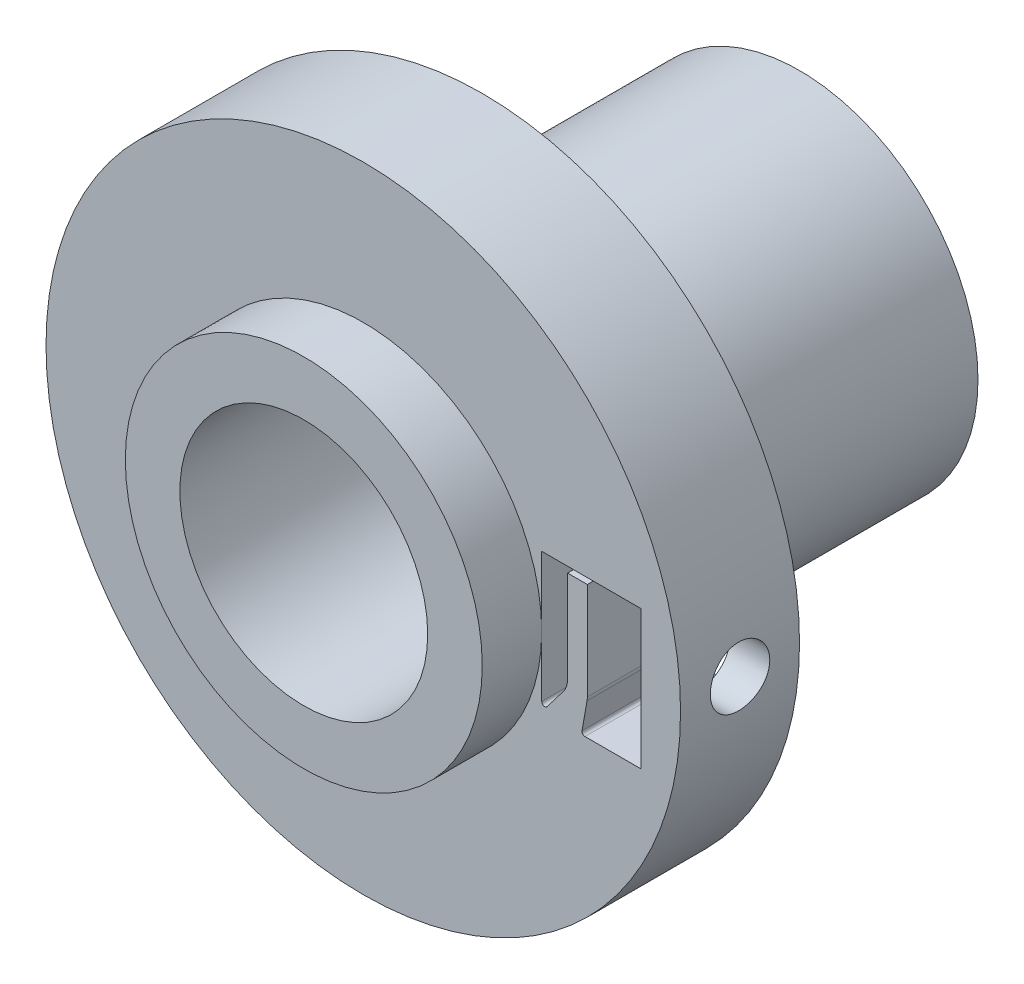
from build123d import *

# Parameters (mm, degrees)
SKIZZE1_R                       = 9
SKIZZE1_R_2                     = 6.25
AUFSATZ_LINEAR_AUSTRAGEN1_DEPTH = 8
SKIZZE2_R                       = 16
SKIZZE2_R_2                     = 6.25
AUFSATZ_LINEAR_AUSTRAGEN2_DEPTH = 6
SCHNITT_LINEAR_AUSTRAGEN1_DEPTH = 6
SCHNITT_LINEAR_START            = 17
SKIZZE4_R                       = 1.5
SCHNITT_LINEAR_AUSTRAGEN2_DEPTH = 4
SKIZZE5_R                       = 9
SKIZZE5_R_2                     = 6.25
AUFSATZ_LINEAR_AUSTRAGEN3_DEPTH = 3
VERRUNDUNG1_R                   = 0.15
VERRUNDUNG2_R                   = 0.15


with BuildPart() as part:
    # Skizze1 → Aufsatz-Linear austragen1 (new, symmetric)
    with BuildSketch(Plane.XY):
        Circle(SKIZZE1_R)
        Circle(SKIZZE1_R_2, mode=Mode.SUBTRACT)
    extrude(amount=AUFSATZ_LINEAR_AUSTRAGEN1_DEPTH, both=True)

    # Skizze2 → Aufsatz-Linear austragen2 (add)
    with BuildSketch(Plane.XY.offset(8)):
        Circle(SKIZZE2_R)
        Circle(SKIZZE2_R_2, mode=Mode.SUBTRACT)
    extrude(amount=AUFSATZ_LINEAR_AUSTRAGEN2_DEPTH)

    # Skizze3 → Schnitt-Linear austragen1 (cut)
    with BuildSketch(Plane(origin=(0, 0, 8), x_dir=(-1, 0, 0), z_dir=(0, 0, -1))):
        with BuildLine():
            Line((-9, -3.5), (-10.094357833, -2.06891668))
            ThreePointArc((-10.094357833, -2.06891668), (-10.24719529, -1.78212384), (-10.3, -1.461466572))
            Line((-10.3, -1.461466572), (-10.3, 3.2))
            Line((-10.3, 3.2), (-11.3, 3.2))
            Line((-11.3, 3.2), (-11.3, -1.712441166))
            ThreePointArc((-11.3, -1.712441166), (-11.296188626, -1.799666281), (-11.284783559, -1.8862265))
            Line((-11.284783559, -1.8862265), (-11, -3.5))
            Line((-11, -3.5), (-14, -3.5))
            Line((-14, -3.5), (-14, 3.5))
            Line((-14, 3.5), (-9, 3.5))
            Line((-9, 3.5), (-9, -3.5))
        make_face()
    extrude(amount=-SCHNITT_LINEAR_AUSTRAGEN1_DEPTH, mode=Mode.SUBTRACT)

    # Skizze4 → Schnitt-Linear austragen2 (cut)
    with BuildSketch(Plane(origin=(0, 0, 0), x_dir=(0, 0, -1), z_dir=(1, 0, 0)).offset(SCHNITT_LINEAR_START)):
        with Locations((-11, 0)):
            Circle(SKIZZE4_R)
    extrude(amount=-SCHNITT_LINEAR_AUSTRAGEN2_DEPTH, mode=Mode.SUBTRACT)

    # Skizze5 → Aufsatz-Linear austragen3 (add)
    with BuildSketch(Plane.XY.offset(14)):
        Circle(SKIZZE5_R)
        Circle(SKIZZE5_R_2, mode=Mode.SUBTRACT)
    extrude(amount=AUFSATZ_LINEAR_AUSTRAGEN3_DEPTH)

    # Verrundung1
    verrundung1_edges = [part.edges().sort_by_distance(p)[0] for p in [
        (9, -3.5, 11),
    ]]
    fillet(verrundung1_edges, radius=VERRUNDUNG1_R)

    # Verrundung2
    verrundung2_edges = [part.edges().sort_by_distance(p)[0] for p in [
        (11, -3.5, 11),
    ]]
    fillet(verrundung2_edges, radius=VERRUNDUNG2_R)


solid = part.part
